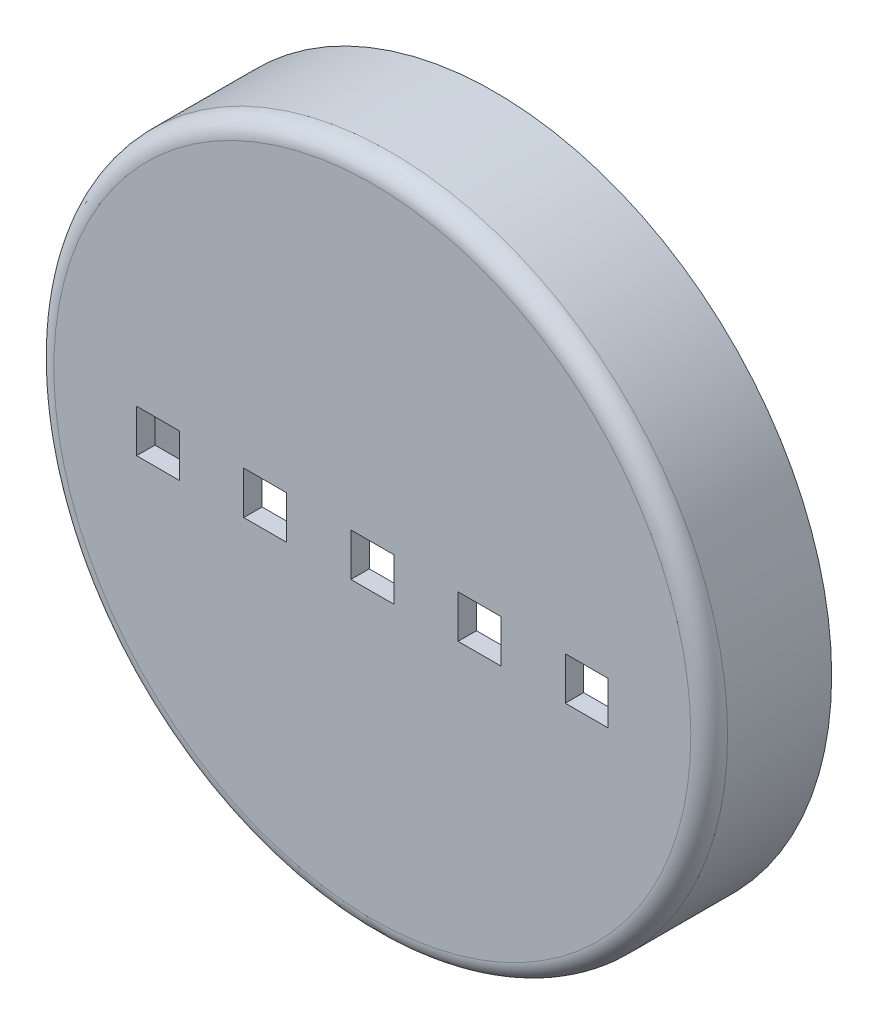
from build123d import *

# Parameters (mm, degrees)
SKETCH1_R           = 55
BOSS_EXTRUDE2_DEPTH = 20
SKETCH2_R           = 51
CUT_EXTRUDE1_DEPTH  = 17
SKETCH10_R          = 1.5
BOSS_EXTRUDE3_DEPTH = 10
SKETCH10_3_W        = 7
SKETCH10_3_H        = 7
CUT_EXTRUDE4_DEPTH  = 10
FILLET1_R           = 3


with BuildPart() as part:
    # Sketch1 → Boss-Extrude2 (new body)
    with BuildSketch(Plane.XY):
        with Locations((328.389379834, 629.271631436)):
            Circle(SKETCH1_R)
    extrude(amount=BOSS_EXTRUDE2_DEPTH)

    # Sketch2 → Cut-Extrude1 (cut)
    with BuildSketch(Plane(origin=(0, 0, 0), x_dir=(-1, 0, 0), z_dir=(0, 0, -1))):
        with Locations((-328.628637891, 629.384320649)):
            Circle(SKETCH2_R)
    extrude(amount=-CUT_EXTRUDE1_DEPTH, mode=Mode.SUBTRACT)

    # Sketch10 → Boss-Extrude3 (add)
    with BuildSketch(Plane(origin=(0, 0, 17), x_dir=(-1, 0, 0), z_dir=(0, 0, -1))):
        with Locations((-374.389379834, 627.076422512)):
            Circle(SKETCH10_R)
        with Locations((-282.389379834, 627.076422512)):
            Circle(SKETCH10_R)
    extrude(amount=BOSS_EXTRUDE3_DEPTH)

    # Sketch10<3> → Cut-Extrude4 (cut)
    with BuildSketch(Plane(origin=(0, 0, 17), x_dir=(-1, 0, 0), z_dir=(0, 0, -1))):
        with Locations((-363.389379834, 627.076422512)):
            Rectangle(SKETCH10_3_W, SKETCH10_3_H)
        with Locations((-345.889379834, 627.076422512)):
            Rectangle(SKETCH10_3_W, SKETCH10_3_H)
        with Locations((-328.389379834, 627.076422512)):
            Rectangle(SKETCH10_3_W, SKETCH10_3_H)
        with Locations((-310.889379834, 627.076422512)):
            Rectangle(SKETCH10_3_W, SKETCH10_3_H)
        with Locations((-293.389379834, 627.076422512)):
            Rectangle(SKETCH10_3_W, SKETCH10_3_H)
    extrude(amount=-CUT_EXTRUDE4_DEPTH, mode=Mode.SUBTRACT)

    # Fillet1
    fillet1_edges = [part.edges().sort_by_distance(p)[0] for p in [
        (273.389379834, 629.271631436, 20),
    ]]
    fillet(fillet1_edges, radius=FILLET1_R)


solid = part.part
